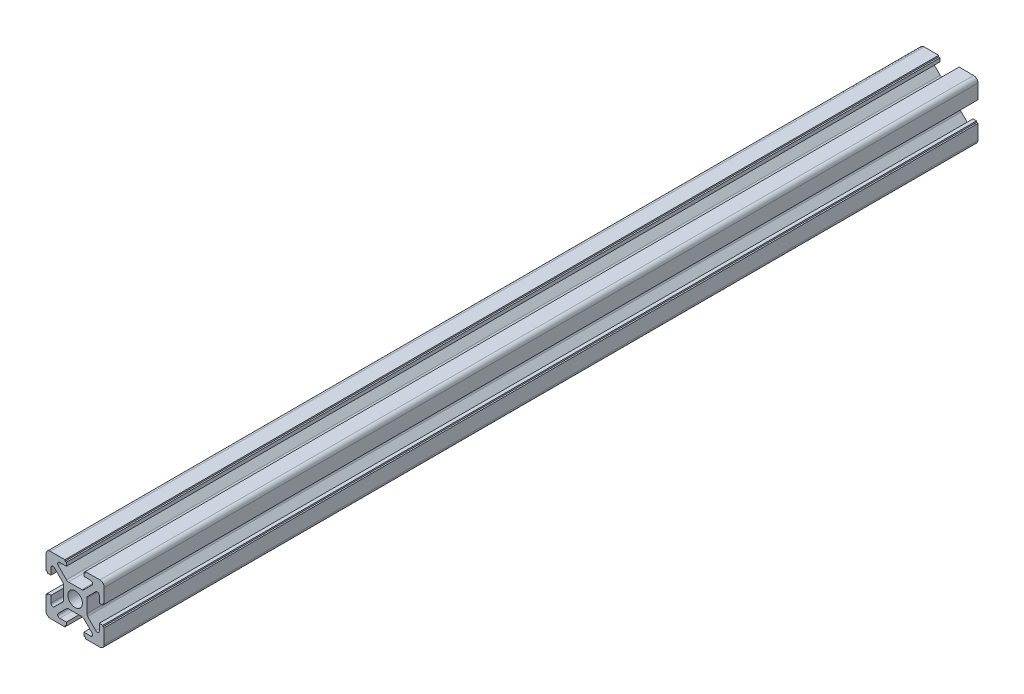
from build123d import *

# Parameters (mm, degrees)
SKETCH_1_R      = 2.5
EXTRUDE_1_DEPTH = 300
EXTRUDE_START   = -300
SKETCH_2_W      = 8
SKETCH_2_H      = 8
SKETCH_2_R      = 2.5
EXTRUDE_2_DEPTH = 300
FILLET_1_R      = 1


with BuildPart() as part:
    # 草图1 → 凸台-拉伸1 (new body)
    with BuildSketch(Plane.XY):
        with BuildLine():
            Line((173.5, -150), (168.5, -150))
            Line((168.5, -150), (168.5, -150.5))
            Line((168.5, -150.5), (168, -150.5))
            Line((168, -150.5), (168, -151.70000008))
            Line((168, -151.70000008), (170.299390173, -151.70000008))
            ThreePointArc((170.299390173, -151.70000008), (170.94610582, -152.132121658), (170.794364905, -152.894974776))
            Line((170.794364905, -152.894974776), (167.175465502, -156.513874235))
            ThreePointArc((167.175465502, -156.513874235), (166.907085014, -156.653013019), (166.607569506, -156.61204781))
            ThreePointArc((166.607569506, -156.61204781), (165.969708818, -156.377547161), (165.299999837, -156.262019281))
            Line((165.299999837, -156.262019281), (165, -156.549999889))
            Line((165, -156.549999889), (164.700000163, -156.262019281))
            ThreePointArc((164.700000163, -156.262019281), (164.030290989, -156.377547213), (163.392430134, -156.61204798))
            ThreePointArc((163.392430134, -156.61204798), (163.092914607, -156.653013217), (162.824534093, -156.513874431))
            Line((162.824534093, -156.513874431), (159.205634442, -152.89497478))
            ThreePointArc((159.205634442, -152.89497478), (159.053893522, -152.13212166), (159.70060917, -151.70000008))
            Line((159.70060917, -151.70000008), (162, -151.70000008))
            Line((162, -151.70000008), (162, -150.5))
            Line((162, -150.5), (161.500000104, -150.5))
            Line((161.500000104, -150.5), (161.500000104, -150))
            Line((161.500000104, -150), (156.500000104, -150))
            ThreePointArc((156.500000104, -150), (155.439339932, -150.439339828), (155.000000104, -151.5))
            Line((155.000000104, -151.5), (155.000000104, -156.5))
            Line((155.000000104, -156.5), (155.500000104, -156.5))
            Line((155.500000104, -156.5), (155.500000104, -157))
            Line((155.500000104, -157), (156.699999897, -157))
            Line((156.699999897, -157), (156.699999897, -154.700608431))
            ThreePointArc((156.699999897, -154.700608431), (157.132121491, -154.053892778), (157.894974619, -154.205633725))
            Line((157.894974619, -154.205633725), (161.513874525, -157.824533943))
            ThreePointArc((161.513874525, -157.824533943), (161.653013299, -158.092914462), (161.61204805, -158.392429988))
            ThreePointArc((161.61204805, -158.392429988), (161.377547255, -159.030290833), (161.262019293, -159.700000002))
            Line((161.262019293, -159.700000002), (161.550000032, -160))
            Line((161.550000032, -160), (161.262019293, -160.299999998))
            ThreePointArc((161.262019293, -160.299999998), (161.37754719, -160.969708925), (161.612047835, -161.607569559))
            ThreePointArc((161.612047835, -161.607569559), (161.653013049, -161.907085066), (161.513874269, -162.175465556))
            Line((161.513874269, -162.175465556), (157.894974601, -165.79436528))
            ThreePointArc((157.894974601, -165.79436528), (157.13212148, -165.946106205), (156.699999897, -165.299390557))
            Line((156.699999897, -165.299390557), (156.699999897, -163))
            Line((156.699999897, -163), (155.500000104, -163))
            Line((155.500000104, -163), (155.500000104, -163.5))
            Line((155.500000104, -163.5), (155.000000104, -163.5))
            Line((155.000000104, -163.5), (155.000000104, -168.5))
            ThreePointArc((155.000000104, -168.5), (155.439339932, -169.560660172), (156.500000104, -170))
            Line((156.500000104, -170), (161.500000104, -170))
            Line((161.500000104, -170), (161.500000104, -169.5))
            Line((161.500000104, -169.5), (162, -169.5))
            Line((162, -169.5), (162, -168.29999992))
            Line((162, -168.29999992), (159.700610052, -168.29999992))
            ThreePointArc((159.700610052, -168.29999992), (159.053894408, -167.867878348), (159.205635312, -167.105025232))
            Line((159.205635312, -167.105025232), (162.824534559, -163.486125803))
            ThreePointArc((162.824534559, -163.486125803), (163.092915044, -163.346987014), (163.392430553, -163.387952218))
            ThreePointArc((163.392430553, -163.387952218), (164.030291195, -163.622452842), (164.700000125, -163.737980716))
            Line((164.700000125, -163.737980716), (165, -163.450000078))
            Line((165, -163.450000078), (165.299999781, -163.737980724))
            ThreePointArc((165.299999781, -163.737980724), (165.969708906, -163.622452815), (166.60756972, -163.387952089))
            ThreePointArc((166.60756972, -163.387952089), (166.907085249, -163.346986865), (167.175465757, -163.486125663))
            Line((167.175465757, -163.486125663), (170.794365024, -167.105025241))
            ThreePointArc((170.794365024, -167.105025241), (170.946105917, -167.867878353), (170.299390275, -168.29999992))
            Line((170.299390275, -168.29999992), (168, -168.29999992))
            Line((168, -168.29999992), (168, -169.5))
            Line((168, -169.5), (168.5, -169.5))
            Line((168.5, -169.5), (168.5, -170))
            Line((168.5, -170), (173.5, -170))
            ThreePointArc((173.5, -170), (174.560660172, -169.560660172), (175, -168.5))
            Line((175, -168.5), (175, -163.5))
            Line((175, -163.5), (174.499999896, -163.5))
            Line((174.499999896, -163.5), (174.499999896, -163))
            Line((174.499999896, -163), (173.300000103, -163))
            Line((173.300000103, -163), (173.300000103, -165.299391013))
            ThreePointArc((173.300000103, -165.299391013), (172.867878523, -165.946106661), (172.105025403, -165.794365741))
            Line((172.105025403, -165.794365741), (168.486125569, -162.175465907))
            ThreePointArc((168.486125569, -162.175465907), (168.346986783, -161.907085393), (168.38795202, -161.607569866))
            ThreePointArc((168.38795202, -161.607569866), (168.622452774, -160.969709062), (168.737980711, -160.299999942))
            Line((168.737980711, -160.299999942), (168.450000002, -160))
            Line((168.450000002, -160), (168.73798071, -159.70000004))
            ThreePointArc((168.73798071, -159.70000004), (168.622452807, -159.030291062), (168.387952137, -158.392430382))
            ThreePointArc((168.387952137, -158.392430382), (168.346986918, -158.092914876), (168.486125693, -157.824534383))
            Line((168.486125693, -157.824534383), (172.10502539, -154.205634503))
            ThreePointArc((172.10502539, -154.205634503), (172.867878514, -154.053893567), (173.300000103, -154.700609218))
            Line((173.300000103, -154.700609218), (173.300000103, -157))
            Line((173.300000103, -157), (174.499999896, -157))
            Line((174.499999896, -157), (174.499999896, -156.5))
            Line((174.499999896, -156.5), (175, -156.5))
            Line((175, -156.5), (175, -151.5))
            ThreePointArc((175, -151.5), (174.560660172, -150.439339828), (173.5, -150))
        make_face()
        with Locations((165, -160)):
            Circle(SKETCH_1_R, mode=Mode.SUBTRACT)
    extrude(amount=EXTRUDE_1_DEPTH)

    # 草图2 → 凸台-拉伸2 (add)
    with BuildSketch(Plane.XY.offset(300).offset(EXTRUDE_START)):
        with Locations((165, -160)):
            Rectangle(SKETCH_2_W, SKETCH_2_H)
        with Locations((165, -160)):
            Circle(SKETCH_2_R, mode=Mode.SUBTRACT)
    extrude(amount=EXTRUDE_2_DEPTH)

    # 圆角1
    fillet_1_edges = [part.edges().sort_by_distance(p)[0] for p in [
        (169, -157.31066005, 150),
        (167.68934005, -164, 150),
        (161, -162.689339833, 150),
        (162.310659662, -156, 150),
        (167.689339729, -156, 150),
        (161, -157.310659374, 150),
        (162.310660387, -164, 150),
        (169, -162.689340338, 150),
    ]]
    fillet(fillet_1_edges, radius=FILLET_1_R)


solid = part.part
